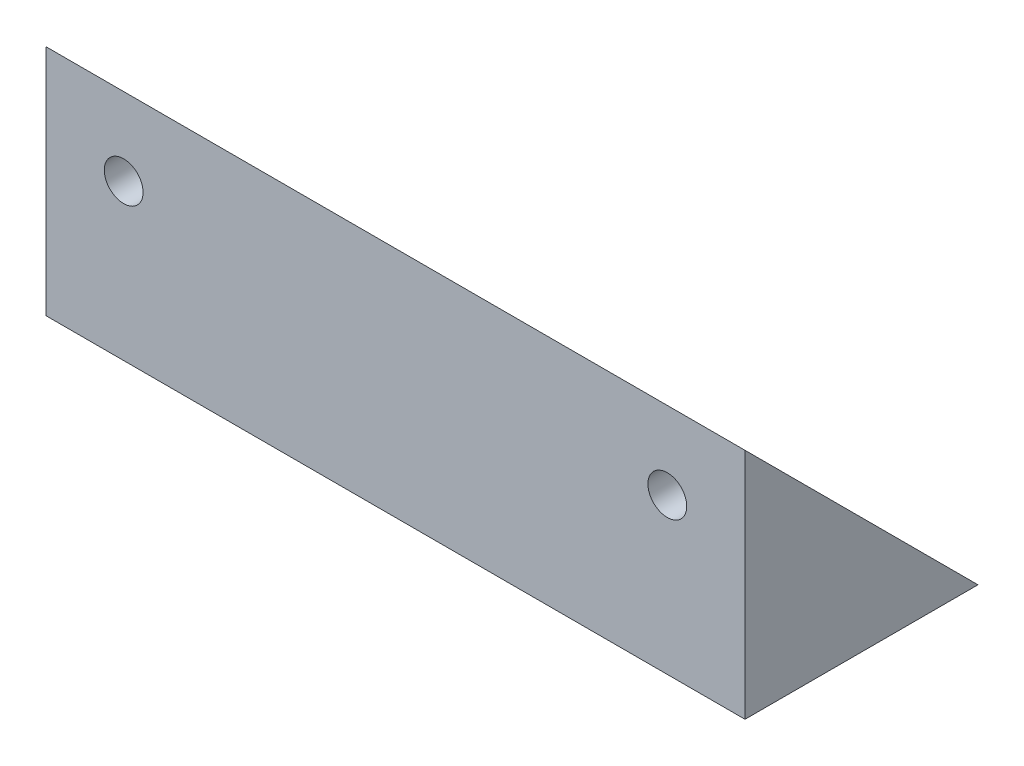
from build123d import *

# Parameters (mm, degrees)
BOSS_EXTRUDE1_DEPTH = 45
CUT_EXTRUDE1_START  = -5
SKETCH2_W           = 12
SKETCH2_H           = 20
CUT_EXTRUDE1_DEPTH  = 57.846584384
SKETCH3_R           = 2.5
CUT_EXTRUDE2_DEPTH  = 62.846584384


with BuildPart() as part:
    # Sketch1 → Boss-Extrude1 (new, symmetric)
    with BuildSketch(Plane(origin=(0, 0, 0), x_dir=(0, 0, -1), z_dir=(1, 0, 0))):
        Polygon((0, 0), (0, 30), (30, 0), align=None)
    extrude(amount=BOSS_EXTRUDE1_DEPTH, both=True)

    # Sketch2 → Cut-Extrude1 (cut, through all)
    with BuildSketch(Plane.XY.offset(CUT_EXTRUDE1_START)):
        with Locations((-35, 20)):
            Rectangle(SKETCH2_W, SKETCH2_H)
        with Locations((34, 20)):
            Rectangle(SKETCH2_W, SKETCH2_H)
    cut_extrude1 = extrude(amount=-CUT_EXTRUDE1_DEPTH, mode=Mode.SUBTRACT)

    # Sketch3 → Cut-Extrude2 (cut, through all)
    with BuildSketch(Plane.XY):
        with Locations((-35, 20)):
            Circle(SKETCH3_R)
        with Locations((35, 20)):
            Circle(SKETCH3_R)
    cut_extrude2 = extrude(amount=-CUT_EXTRUDE2_DEPTH, mode=Mode.SUBTRACT)

    # Mirror1: Cut-Extrude1, Cut-Extrude2 across plane
    add(cut_extrude1.mirror(Plane(origin=(0, 0, 0), x_dir=(0, -0.7071067811865477, 0.7071067811865474), z_dir=(0, -0.7071067811865476, -0.7071067811865476))), mode=Mode.SUBTRACT)
    add(cut_extrude2.mirror(Plane(origin=(0, 0, 0), x_dir=(0, -0.7071067811865477, 0.7071067811865474), z_dir=(0, -0.7071067811865476, -0.7071067811865476))), mode=Mode.SUBTRACT)


solid = part.part
